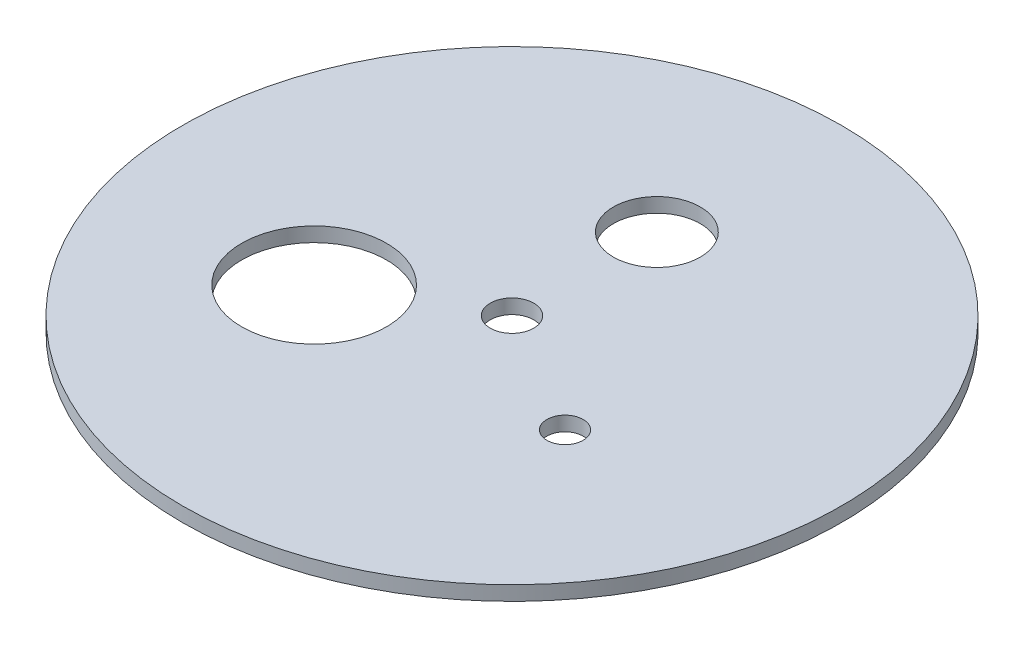
from build123d import *

# Parameters (mm, degrees)
SKETCH1_R           = 45.5
SKETCH1_R_2         = 6
SKETCH1_R_3         = 10
SKETCH1_R_4         = 2.5
SKETCH1_R_5         = 3
BOSS_EXTRUDE1_DEPTH = 2


with BuildPart() as part:
    # Sketch1 → Boss-Extrude1 (new body)
    with BuildSketch(Plane(origin=(0, 0, 0), x_dir=(1, 0, 0), z_dir=(0, 1, 0))):
        with Locations(Location((0, 0, 0), (0, 0, 270))):
            Circle(SKETCH1_R)
        with Locations(Location((0, 20, 0), (0, 0, 270))):
            Circle(SKETCH1_R_2, mode=Mode.SUBTRACT)
        with Locations(Location((-17.320508076, -10, 0), (0, 0, 270))):
            Circle(SKETCH1_R_3, mode=Mode.SUBTRACT)
        with Locations(Location((17.320508076, -10, 0), (0, 0, 270))):
            Circle(SKETCH1_R_4, mode=Mode.SUBTRACT)
        with Locations(Location((0, 0, 0), (0, 0, 270))):
            Circle(SKETCH1_R_5, mode=Mode.SUBTRACT)
    extrude(amount=BOSS_EXTRUDE1_DEPTH)


solid = part.part
